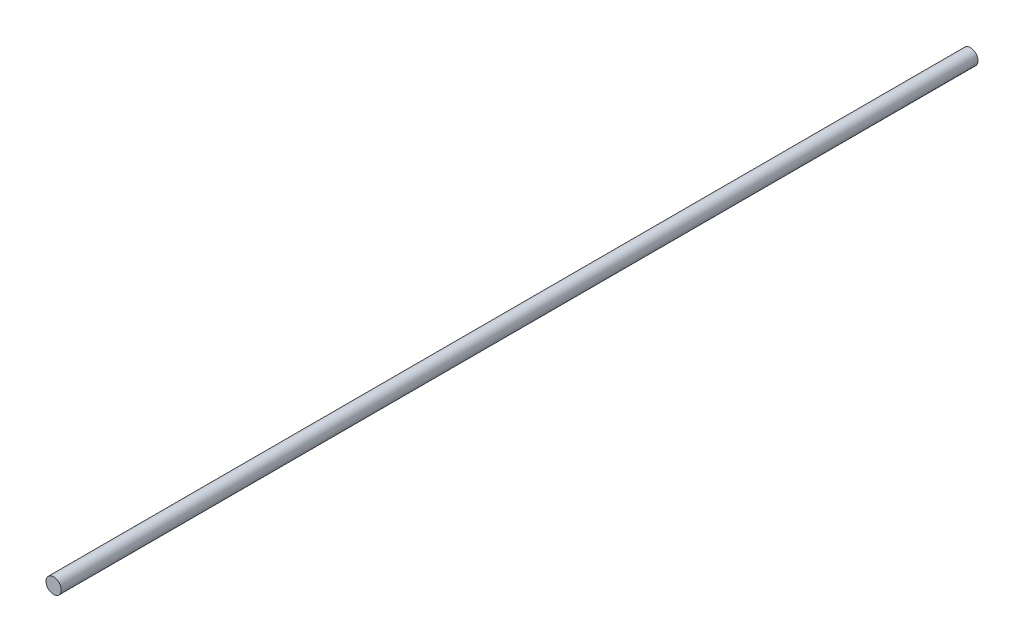
from build123d import *

# Parameters (mm, degrees)
SKETCH_1_R      = 0.5
EXTRUDE_1_DEPTH = 60


with BuildPart() as part:
    # 草图1 → 凸台-拉伸1 (new body)
    with BuildSketch(Plane.XY):
        Circle(SKETCH_1_R)
    extrude(amount=EXTRUDE_1_DEPTH)


solid = part.part
